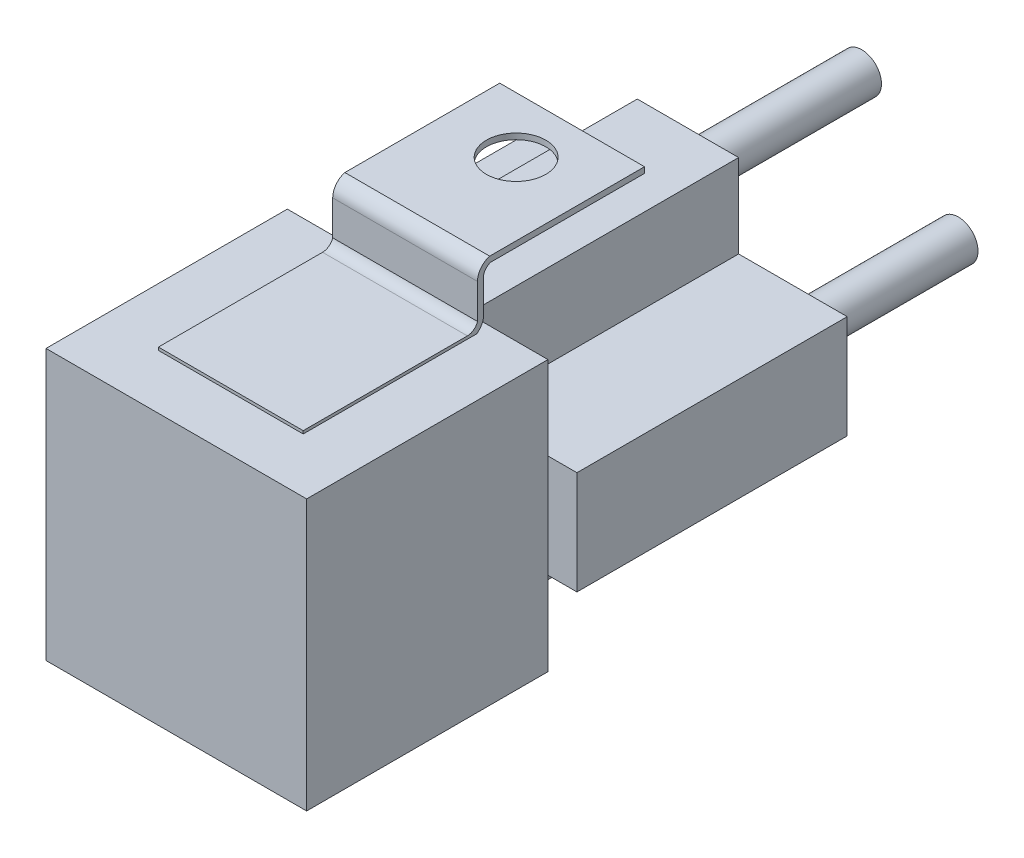
from build123d import *

# Parameters (mm, degrees)
SKETCH1_W           = 27
SKETCH1_H           = 28
BOSS_EXTRUDE1_DEPTH = 25
SKETCH2_W           = 33
SKETCH2_H           = 10.7
SKETCH2_W_2         = 10.5
SKETCH2_H_2         = 28
BOSS_EXTRUDE2_DEPTH = 28
SKETCH3_R           = 2.05
BOSS_EXTRUDE3_DEPTH = 18
EXTRUDE_THIN1_DEPTH = 7.5
MOUNTING_HOLE_REACH = 61.705
SKETCH5_R           = 3.075


with BuildPart() as part:
    # Sketch1 → Boss-Extrude1 (new body)
    with BuildSketch(Plane.XY):
        Rectangle(SKETCH1_W, SKETCH1_H)
    extrude(amount=BOSS_EXTRUDE1_DEPTH)

    # Sketch2 → Boss-Extrude2 (add)
    with BuildSketch(Plane.XY):
        Rectangle(SKETCH2_W, SKETCH2_H)
        Rectangle(SKETCH2_W_2, SKETCH2_H_2)
    extrude(amount=-BOSS_EXTRUDE2_DEPTH)

    # Sketch3 → Boss-Extrude3 (add)
    with BuildSketch(Plane(origin=(0, 0, -28), x_dir=(-1, 0, 0), z_dir=(0, 0, -1))):
        with Locations((-10, 0)):
            Circle(SKETCH3_R)
        with Locations((10, 0)):
            Circle(SKETCH3_R)
        with Locations((0, 10)):
            Circle(SKETCH3_R)
        with Locations((0, -10)):
            Circle(SKETCH3_R)
    extrude(amount=BOSS_EXTRUDE3_DEPTH)

    # Sketch4 → Extrude-Thin1 (add, symmetric)
    with BuildSketch(Plane(origin=(0, 0, 0), x_dir=(0, 0, -1), z_dir=(1, 0, 0))):
        with BuildLine():
            Line((-19.356513239, 13.7), (-2.349136171, 13.7))
            ThreePointArc((-2.349136171, 13.7), (-1.303107706, 14.059916252), (-0.7, 14.987265351))
            Line((-0.7, 14.987265351), (-0.7, 18.658359214))
            ThreePointArc((-0.7, 18.658359214), (-0.494115365, 19.29910699), (0.04646857, 19.7))
            Line((0.04646857, 19.7), (16, 19.7))
            Line((16, 19.7), (16, 20.3))
            Line((16, 20.3), (-0.041605625, 20.3))
            ThreePointArc((-0.041605625, 20.3), (-0.949208947, 19.692590918), (-1.3, 18.658359214))
            Line((-1.3, 18.658359214), (-1.3, 15.069374388))
            ThreePointArc((-1.3, 15.069374388), (-1.698631818, 14.512957675), (-2.349136171, 14.3))
            Line((-2.349136171, 14.3), (-19.356513239, 14.3))
            Line((-19.356513239, 14.3), (-19.356513239, 13.7))
        make_face()
    extrude(amount=EXTRUDE_THIN1_DEPTH, both=True)

    # Sketch5 → Mounting Hole (cut, up to next)
    with BuildSketch(Plane(origin=(0, 20.3, 0), x_dir=(1, 0, 0), z_dir=(0, 1, 0)), mode=Mode.PRIVATE) as mounting_hole_sk1:
        with Locations(Location((0, 10.2, 0), (0, 0, 270))):
            Circle(SKETCH5_R)
    mounting_hole_tool1 = extrude(mounting_hole_sk1.sketch, amount=-MOUNTING_HOLE_REACH, mode=Mode.PRIVATE) & part.part
    add(mounting_hole_tool1.solids().sort_by_distance((0, 20.3, -10.2))[0], mode=Mode.SUBTRACT)


solid = part.part
